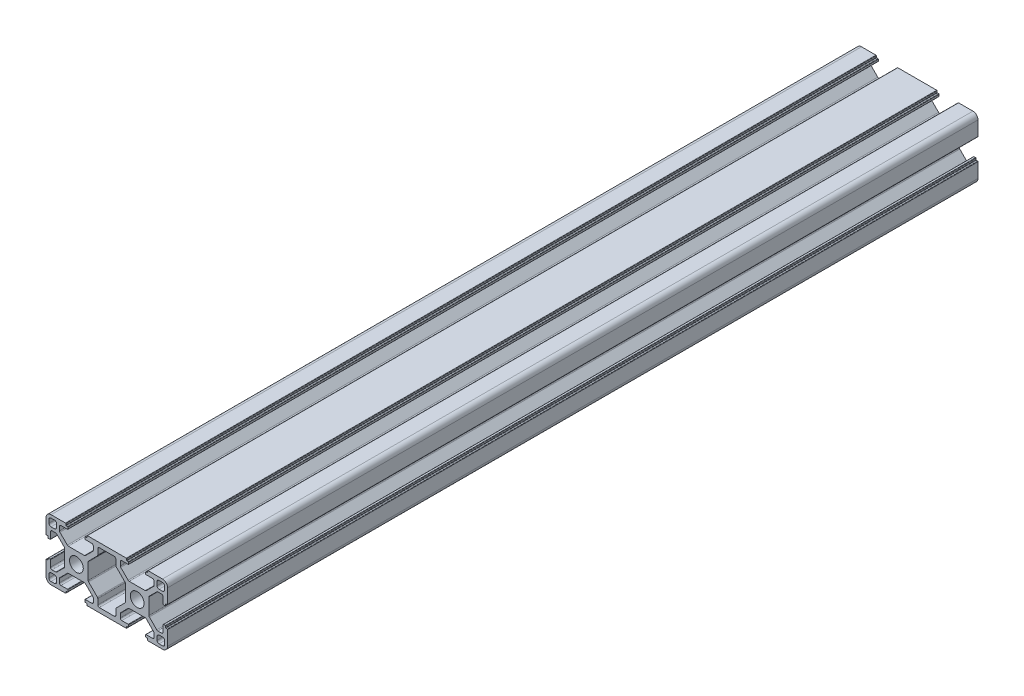
from build123d import *

# Parameters (mm, degrees)
SKETCH1_R           = 3.4
BOSS_EXTRUDE1_DEPTH = 400


with BuildPart() as part:
    # Sketch1 → Boss-Extrude1 (new body)
    with BuildSketch(Plane.XY):
        with BuildLine():
            Line((2.5, 0), (9.6, 0))
            ThreePointArc((9.6, 0), (9.741421356, 0.058578644), (9.8, 0.2))
            Line((9.8, 0.2), (9.8, 0.8))
            ThreePointArc((9.8, 0.8), (9.858578644, 0.941421356), (10, 1))
            Line((10, 1), (10.555634919, 1))
            ThreePointArc((10.555634919, 1), (10.697056275, 1.058578644), (10.755634919, 1.2))
            Line((10.755634919, 1.2), (10.755634919, 2))
            ThreePointArc((10.755634919, 2), (10.697056275, 2.141421356), (10.555634919, 2.2))
            Line((10.555634919, 2.2), (7.4, 2.2))
            ThreePointArc((7.4, 2.2), (6.869669914, 2.419669914), (6.65, 2.95))
            Line((6.65, 2.95), (6.65, 4.78370491))
            ThreePointArc((6.65, 4.78370491), (6.707090351, 5.070717484), (6.869669914, 5.314034996))
            Line((6.869669914, 5.314034996), (10.535965004, 8.980330086))
            ThreePointArc((10.535965004, 8.980330086), (10.779282516, 9.142909649), (11.06629509, 9.2))
            Line((11.06629509, 9.2), (18.93370491, 9.2))
            ThreePointArc((18.93370491, 9.2), (19.220717484, 9.142909649), (19.464034995, 8.980330086))
            Line((19.464034995, 8.980330086), (23.130330086, 5.314034996))
            ThreePointArc((23.130330086, 5.314034996), (23.292909649, 5.070717484), (23.35, 4.78370491))
            Line((23.35, 4.78370491), (23.35, 2.95))
            ThreePointArc((23.35, 2.95), (23.130330086, 2.419669914), (22.6, 2.2))
            Line((22.6, 2.2), (19.355634919, 2.2))
            ThreePointArc((19.355634919, 2.2), (19.214213562, 2.141421356), (19.155634919, 2))
            Line((19.155634919, 2), (19.155634919, 1.2))
            ThreePointArc((19.155634919, 1.2), (19.214213562, 1.058578644), (19.355634919, 1))
            Line((19.355634919, 1), (19.955634919, 1))
            ThreePointArc((19.955634919, 1), (20.097056275, 0.941421356), (20.155634919, 0.8))
            Line((20.155634919, 0.8), (20.155634919, 0.2))
            ThreePointArc((20.155634919, 0.2), (20.214213562, 0.058578644), (20.355634919, 0))
            Line((20.355634919, 0), (39.6, 0))
            ThreePointArc((39.6, 0), (39.741421356, 0.058578644), (39.8, 0.2))
            Line((39.8, 0.2), (39.8, 0.8))
            ThreePointArc((39.8, 0.8), (39.858578644, 0.941421356), (40, 1))
            Line((40, 1), (40.555634919, 1))
            ThreePointArc((40.555634919, 1), (40.697056275, 1.058578644), (40.755634919, 1.2))
            Line((40.755634919, 1.2), (40.755634919, 2))
            ThreePointArc((40.755634919, 2), (40.697056275, 2.141421356), (40.555634919, 2.2))
            Line((40.555634919, 2.2), (37.4, 2.2))
            ThreePointArc((37.4, 2.2), (36.869669914, 2.419669914), (36.65, 2.95))
            Line((36.65, 2.95), (36.65, 4.78370491))
            ThreePointArc((36.65, 4.78370491), (36.707090351, 5.070717484), (36.869669914, 5.314034995))
            Line((36.869669914, 5.314034995), (40.535965005, 8.980330086))
            ThreePointArc((40.535965005, 8.980330086), (40.779282516, 9.142909649), (41.06629509, 9.2))
            Line((41.06629509, 9.2), (48.93370491, 9.2))
            ThreePointArc((48.93370491, 9.2), (49.220717484, 9.142909649), (49.464034995, 8.980330086))
            Line((49.464034995, 8.980330086), (53.130330086, 5.314034995))
            ThreePointArc((53.130330086, 5.314034995), (53.292909649, 5.070717484), (53.35, 4.78370491))
            Line((53.35, 4.78370491), (53.35, 2.95))
            ThreePointArc((53.35, 2.95), (53.130330086, 2.419669914), (52.6, 2.2))
            Line((52.6, 2.2), (49.355634919, 2.2))
            ThreePointArc((49.355634919, 2.2), (49.214213562, 2.141421356), (49.155634919, 2))
            Line((49.155634919, 2), (49.155634919, 1.2))
            ThreePointArc((49.155634919, 1.2), (49.214213562, 1.058578644), (49.355634919, 1))
            Line((49.355634919, 1), (49.955634919, 1))
            ThreePointArc((49.955634919, 1), (50.097056275, 0.941421356), (50.155634919, 0.8))
            Line((50.155634919, 0.8), (50.155634919, 0.2))
            ThreePointArc((50.155634919, 0.2), (50.214213562, 0.058578644), (50.355634919, 0))
            Line((50.355634919, 0), (57.5, 0))
            ThreePointArc((57.5, 0), (59.267766953, 0.732233047), (60, 2.5))
            Line((60, 2.5), (60, 9.6))
            ThreePointArc((60, 9.6), (59.941421356, 9.741421356), (59.8, 9.8))
            Line((59.8, 9.8), (59.2, 9.8))
            ThreePointArc((59.2, 9.8), (59.058578644, 9.858578644), (59, 10))
            Line((59, 10), (59, 10.6))
            ThreePointArc((59, 10.6), (58.941421356, 10.741421356), (58.8, 10.8))
            Line((58.8, 10.8), (58, 10.8))
            ThreePointArc((58, 10.8), (57.858578644, 10.741421356), (57.8, 10.6))
            Line((57.8, 10.6), (57.8, 7.4))
            ThreePointArc((57.8, 7.4), (57.580330086, 6.869669914), (57.05, 6.65))
            Line((57.05, 6.65), (55.21629509, 6.65))
            ThreePointArc((55.21629509, 6.65), (54.929282516, 6.707090351), (54.685965005, 6.869669914))
            Line((54.685965005, 6.869669914), (51.019669914, 10.535965004))
            ThreePointArc((51.019669914, 10.535965004), (50.857090351, 10.779282516), (50.8, 11.06629509))
            Line((50.8, 11.06629509), (50.8, 18.93370491))
            ThreePointArc((50.8, 18.93370491), (50.857090351, 19.220717484), (51.019669914, 19.464034996))
            Line((51.019669914, 19.464034996), (54.685965004, 23.130330086))
            ThreePointArc((54.685965004, 23.130330086), (54.929282516, 23.292909649), (55.21629509, 23.35))
            Line((55.21629509, 23.35), (57.05, 23.35))
            ThreePointArc((57.05, 23.35), (57.580330086, 23.130330086), (57.8, 22.6))
            Line((57.8, 22.6), (57.8, 19.4))
            ThreePointArc((57.8, 19.4), (57.858578644, 19.258578644), (58, 19.2))
            Line((58, 19.2), (58.8, 19.2))
            ThreePointArc((58.8, 19.2), (58.941421356, 19.258578644), (59, 19.4))
            Line((59, 19.4), (59, 20))
            ThreePointArc((59, 20), (59.058578644, 20.141421356), (59.2, 20.2))
            Line((59.2, 20.2), (59.8, 20.2))
            ThreePointArc((59.8, 20.2), (59.941421356, 20.258578644), (60, 20.4))
            Line((60, 20.4), (60, 27.5))
            ThreePointArc((60, 27.5), (59.267766953, 29.267766953), (57.5, 30))
            Line((57.5, 30), (50.4, 30))
            ThreePointArc((50.4, 30), (50.258578644, 29.941421356), (50.2, 29.8))
            Line((50.2, 29.8), (50.2, 29.2))
            ThreePointArc((50.2, 29.2), (50.141421356, 29.058578644), (50, 29))
            Line((50, 29), (49.4, 29))
            ThreePointArc((49.4, 29), (49.258578644, 28.941421356), (49.2, 28.8))
            Line((49.2, 28.8), (49.2, 28))
            ThreePointArc((49.2, 28), (49.258578644, 27.858578644), (49.4, 27.8))
            Line((49.4, 27.8), (52.6, 27.8))
            ThreePointArc((52.6, 27.8), (53.130330086, 27.580330086), (53.35, 27.05))
            Line((53.35, 27.05), (53.35, 25.21629509))
            ThreePointArc((53.35, 25.21629509), (53.292909649, 24.929282516), (53.130330086, 24.685965005))
            Line((53.130330086, 24.685965005), (49.464034995, 21.019669914))
            ThreePointArc((49.464034995, 21.019669914), (49.220717484, 20.857090351), (48.93370491, 20.8))
            Line((48.93370491, 20.8), (41.06629509, 20.8))
            ThreePointArc((41.06629509, 20.8), (40.779282516, 20.857090351), (40.535965005, 21.019669914))
            Line((40.535965005, 21.019669914), (36.869669914, 24.685965004))
            ThreePointArc((36.869669914, 24.685965004), (36.707090351, 24.929282516), (36.65, 25.21629509))
            Line((36.65, 25.21629509), (36.65, 27.05))
            ThreePointArc((36.65, 27.05), (36.869669914, 27.580330086), (37.4, 27.8))
            Line((37.4, 27.8), (40.6, 27.8))
            ThreePointArc((40.6, 27.8), (40.741421356, 27.858578644), (40.8, 28))
            Line((40.8, 28), (40.8, 28.8))
            ThreePointArc((40.8, 28.8), (40.741421356, 28.941421356), (40.6, 29))
            Line((40.6, 29), (40, 29))
            ThreePointArc((40, 29), (39.858578644, 29.058578644), (39.8, 29.2))
            Line((39.8, 29.2), (39.8, 29.8))
            ThreePointArc((39.8, 29.8), (39.741421356, 29.941421356), (39.6, 30))
            Line((39.6, 30), (20.4, 30))
            ThreePointArc((20.4, 30), (20.258578644, 29.941421356), (20.2, 29.8))
            Line((20.2, 29.8), (20.2, 29.2))
            ThreePointArc((20.2, 29.2), (20.141421356, 29.058578644), (20, 29))
            Line((20, 29), (19.4, 29))
            ThreePointArc((19.4, 29), (19.258578644, 28.941421356), (19.2, 28.8))
            Line((19.2, 28.8), (19.2, 28))
            ThreePointArc((19.2, 28), (19.258578644, 27.858578644), (19.4, 27.8))
            Line((19.4, 27.8), (22.6, 27.8))
            ThreePointArc((22.6, 27.8), (23.130330086, 27.580330086), (23.35, 27.05))
            Line((23.35, 27.05), (23.35, 25.21629509))
            ThreePointArc((23.35, 25.21629509), (23.292909649, 24.929282516), (23.130330086, 24.685965004))
            Line((23.130330086, 24.685965004), (19.464034995, 21.019669914))
            ThreePointArc((19.464034995, 21.019669914), (19.220717484, 20.857090351), (18.93370491, 20.8))
            Line((18.93370491, 20.8), (11.06629509, 20.8))
            ThreePointArc((11.06629509, 20.8), (10.779282516, 20.857090351), (10.535965004, 21.019669914))
            Line((10.535965004, 21.019669914), (6.869669914, 24.685965005))
            ThreePointArc((6.869669914, 24.685965005), (6.707090351, 24.929282516), (6.65, 25.21629509))
            Line((6.65, 25.21629509), (6.65, 27.05))
            ThreePointArc((6.65, 27.05), (6.869669914, 27.580330086), (7.4, 27.8))
            Line((7.4, 27.8), (10.6, 27.8))
            ThreePointArc((10.6, 27.8), (10.741421356, 27.858578644), (10.8, 28))
            Line((10.8, 28), (10.8, 28.8))
            ThreePointArc((10.8, 28.8), (10.741421356, 28.941421356), (10.6, 29))
            Line((10.6, 29), (10, 29))
            ThreePointArc((10, 29), (9.858578644, 29.058578644), (9.8, 29.2))
            Line((9.8, 29.2), (9.8, 29.8))
            ThreePointArc((9.8, 29.8), (9.741421356, 29.941421356), (9.6, 30))
            Line((9.6, 30), (2.5, 30))
            ThreePointArc((2.5, 30), (0.732233047, 29.267766953), (0, 27.5))
            Line((0, 27.5), (0, 20.4))
            ThreePointArc((0, 20.4), (0.058578644, 20.258578644), (0.2, 20.2))
            Line((0.2, 20.2), (0.8, 20.2))
            ThreePointArc((0.8, 20.2), (0.941421356, 20.141421356), (1, 20))
            Line((1, 20), (1, 19.4))
            ThreePointArc((1, 19.4), (1.058578644, 19.258578644), (1.2, 19.2))
            Line((1.2, 19.2), (2, 19.2))
            ThreePointArc((2, 19.2), (2.141421356, 19.258578644), (2.2, 19.4))
            Line((2.2, 19.4), (2.2, 22.6))
            ThreePointArc((2.2, 22.6), (2.419669914, 23.130330086), (2.95, 23.35))
            Line((2.95, 23.35), (4.78370491, 23.35))
            ThreePointArc((4.78370491, 23.35), (5.070717484, 23.292909649), (5.314034995, 23.130330086))
            Line((5.314034995, 23.130330086), (8.980330086, 19.464034995))
            ThreePointArc((8.980330086, 19.464034995), (9.142909649, 19.220717484), (9.2, 18.93370491))
            Line((9.2, 18.93370491), (9.2, 11.06629509))
            ThreePointArc((9.2, 11.06629509), (9.142909649, 10.779282516), (8.980330086, 10.535965005))
            Line((8.980330086, 10.535965005), (5.314034995, 6.869669914))
            ThreePointArc((5.314034995, 6.869669914), (5.070717484, 6.707090351), (4.78370491, 6.65))
            Line((4.78370491, 6.65), (2.95, 6.65))
            ThreePointArc((2.95, 6.65), (2.419669914, 6.869669914), (2.2, 7.4))
            Line((2.2, 7.4), (2.2, 10.6))
            ThreePointArc((2.2, 10.6), (2.141421356, 10.741421356), (2, 10.8))
            Line((2, 10.8), (1.2, 10.8))
            ThreePointArc((1.2, 10.8), (1.058578644, 10.741421356), (1, 10.6))
            Line((1, 10.6), (1, 10))
            ThreePointArc((1, 10), (0.941421356, 9.858578644), (0.8, 9.8))
            Line((0.8, 9.8), (0.2, 9.8))
            ThreePointArc((0.2, 9.8), (0.058578644, 9.741421356), (0, 9.6))
            Line((0, 9.6), (0, 2.5))
            ThreePointArc((0, 2.5), (0.732233047, 0.732233047), (2.5, 0))
        make_face()
        with Locations((15, 15)):
            Circle(SKETCH1_R, mode=Mode.SUBTRACT)
        with Locations((45, 15)):
            Circle(SKETCH1_R, mode=Mode.SUBTRACT)
        with BuildLine():
            Line((21.019669914, 10.535965005), (25.330330086, 6.225304833))
            ThreePointArc((25.330330086, 6.225304833), (25.492909649, 5.981987321), (25.55, 5.694974747))
            Line((25.55, 5.694974747), (25.55, 2.95))
            ThreePointArc((25.55, 2.95), (25.769669914, 2.419669914), (26.3, 2.2))
            Line((26.3, 2.2), (33.7, 2.2))
            ThreePointArc((33.7, 2.2), (34.230330086, 2.419669914), (34.45, 2.95))
            Line((34.45, 2.95), (34.45, 5.694974747))
            ThreePointArc((34.45, 5.694974747), (34.507090351, 5.981987321), (34.669669914, 6.225304833))
            Line((34.669669914, 6.225304833), (38.980330086, 10.535965005))
            ThreePointArc((38.980330086, 10.535965005), (39.142909649, 10.779282516), (39.2, 11.06629509))
            Line((39.2, 11.06629509), (39.2, 18.93370491))
            ThreePointArc((39.2, 18.93370491), (39.142909649, 19.220717484), (38.980330086, 19.464034995))
            Line((38.980330086, 19.464034995), (34.669669914, 23.774695167))
            ThreePointArc((34.669669914, 23.774695167), (34.507090351, 24.018012679), (34.45, 24.305025253))
            Line((34.45, 24.305025253), (34.45, 27.05))
            ThreePointArc((34.45, 27.05), (34.230330086, 27.580330086), (33.7, 27.8))
            Line((33.7, 27.8), (26.3, 27.8))
            ThreePointArc((26.3, 27.8), (25.769669914, 27.580330086), (25.55, 27.05))
            Line((25.55, 27.05), (25.55, 24.305025253))
            ThreePointArc((25.55, 24.305025253), (25.492909649, 24.018012679), (25.330330086, 23.774695167))
            Line((25.330330086, 23.774695167), (21.019669914, 19.464034996))
            ThreePointArc((21.019669914, 19.464034996), (20.857090351, 19.220717484), (20.8, 18.93370491))
            Line((20.8, 18.93370491), (20.8, 11.06629509))
            ThreePointArc((20.8, 11.06629509), (20.857090351, 10.779282516), (21.019669914, 10.535965005))
        make_face(mode=Mode.SUBTRACT)
        with BuildLine():
            Line((4.2, 24.8), (2.45, 24.8))
            ThreePointArc((2.45, 24.8), (1.742893219, 25.092893219), (1.45, 25.8))
            Line((1.45, 25.8), (1.45, 27.55))
            ThreePointArc((1.45, 27.55), (1.742893219, 28.257106781), (2.45, 28.55))
            Line((2.45, 28.55), (4.2, 28.55))
            ThreePointArc((4.2, 28.55), (4.907106781, 28.257106781), (5.2, 27.55))
            Line((5.2, 27.55), (5.2, 25.8))
            ThreePointArc((5.2, 25.8), (4.907106781, 25.092893219), (4.2, 24.8))
        make_face(mode=Mode.SUBTRACT)
        with BuildLine():
            Line((55.8, 28.55), (57.55, 28.55))
            ThreePointArc((57.55, 28.55), (58.257106781, 28.257106781), (58.55, 27.55))
            Line((58.55, 27.55), (58.55, 25.8))
            ThreePointArc((58.55, 25.8), (58.257106781, 25.092893219), (57.55, 24.8))
            Line((57.55, 24.8), (55.8, 24.8))
            ThreePointArc((55.8, 24.8), (55.092893219, 25.092893219), (54.8, 25.8))
            Line((54.8, 25.8), (54.8, 27.55))
            ThreePointArc((54.8, 27.55), (55.092893219, 28.257106781), (55.8, 28.55))
        make_face(mode=Mode.SUBTRACT)
        with BuildLine():
            Line((58.55, 4.2), (58.55, 2.45))
            ThreePointArc((58.55, 2.45), (58.257106781, 1.742893219), (57.55, 1.45))
            Line((57.55, 1.45), (55.8, 1.45))
            ThreePointArc((55.8, 1.45), (55.092893219, 1.742893219), (54.8, 2.45))
            Line((54.8, 2.45), (54.8, 4.2))
            ThreePointArc((54.8, 4.2), (55.092893219, 4.907106781), (55.8, 5.2))
            Line((55.8, 5.2), (57.55, 5.2))
            ThreePointArc((57.55, 5.2), (58.257106781, 4.907106781), (58.55, 4.2))
        make_face(mode=Mode.SUBTRACT)
        with BuildLine():
            Line((1.45, 4.2), (1.45, 2.45))
            ThreePointArc((1.45, 2.45), (1.742893219, 1.742893219), (2.45, 1.45))
            Line((2.45, 1.45), (4.2, 1.45))
            ThreePointArc((4.2, 1.45), (4.907106781, 1.742893219), (5.2, 2.45))
            Line((5.2, 2.45), (5.2, 4.2))
            ThreePointArc((5.2, 4.2), (4.907106781, 4.907106781), (4.2, 5.2))
            Line((4.2, 5.2), (2.45, 5.2))
            ThreePointArc((2.45, 5.2), (1.742893219, 4.907106781), (1.45, 4.2))
        make_face(mode=Mode.SUBTRACT)
    extrude(amount=BOSS_EXTRUDE1_DEPTH)


solid = part.part
